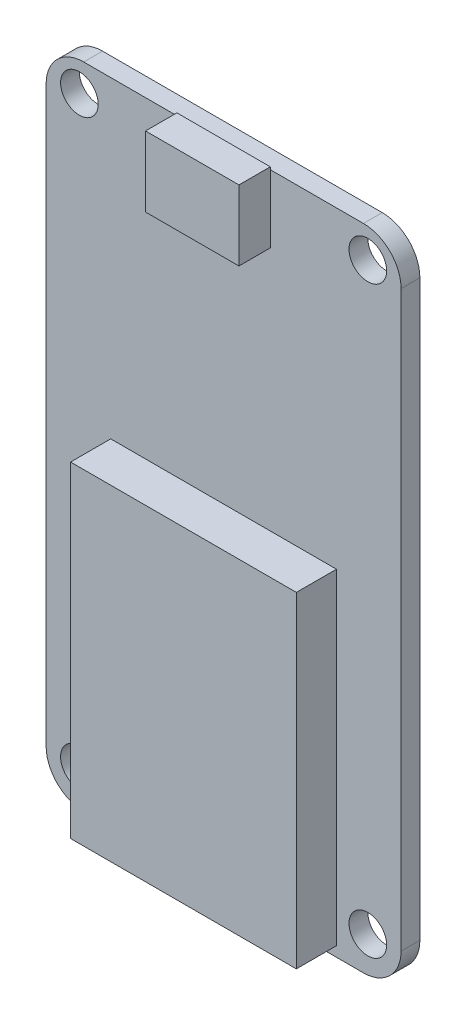
from build123d import *

# Parameters (mm, degrees)
SKETCH1_W           = 28.3
SKETCH1_H           = 51.75
SKETCH1_R           = 1.5
BOSS_EXTRUDE1_DEPTH = 1.5
FILLET1_R           = 3
SKETCH2_W           = 18
SKETCH2_H           = 26
BOSS_EXTRUDE2_DEPTH = 3.2
SKETCH3_W           = 7.45
SKETCH3_H           = 5.6
BOSS_EXTRUDE3_DEPTH = 2.5


with BuildPart() as part:
    # Sketch1 → Boss-Extrude1 (new body)
    with BuildSketch(Plane.XY):
        with Locations((14.15, 25.875)):
            Rectangle(SKETCH1_W, SKETCH1_H)
        with Locations((2.65, 49.4)):
            Circle(SKETCH1_R, mode=Mode.SUBTRACT)
        with Locations((25.65, 49.4)):
            Circle(SKETCH1_R, mode=Mode.SUBTRACT)
        with Locations((2.65, 2.85)):
            Circle(SKETCH1_R, mode=Mode.SUBTRACT)
        with Locations((25.65, 2.85)):
            Circle(SKETCH1_R, mode=Mode.SUBTRACT)
    extrude(amount=BOSS_EXTRUDE1_DEPTH)

    # Fillet1
    fillet1_edges = [part.edges().sort_by_distance(p)[0] for p in [
        (0, 51.75, 0.75),
        (28.3, 51.75, 0.75),
        (28.3, 0, 0.75),
        (0, 0, 0.75),
    ]]
    fillet(fillet1_edges, radius=FILLET1_R)

    # Sketch2 → Boss-Extrude2 (add)
    with BuildSketch(Plane.XY.offset(1.5)):
        with Locations((14.15, 13.8)):
            Rectangle(SKETCH2_W, SKETCH2_H)
    extrude(amount=BOSS_EXTRUDE2_DEPTH)

    # Sketch3 → Boss-Extrude3 (add)
    with BuildSketch(Plane.XY.offset(1.5)):
        with Locations((14.15, 49.15)):
            Rectangle(SKETCH3_W, SKETCH3_H)
    extrude(amount=BOSS_EXTRUDE3_DEPTH)


solid = part.part
